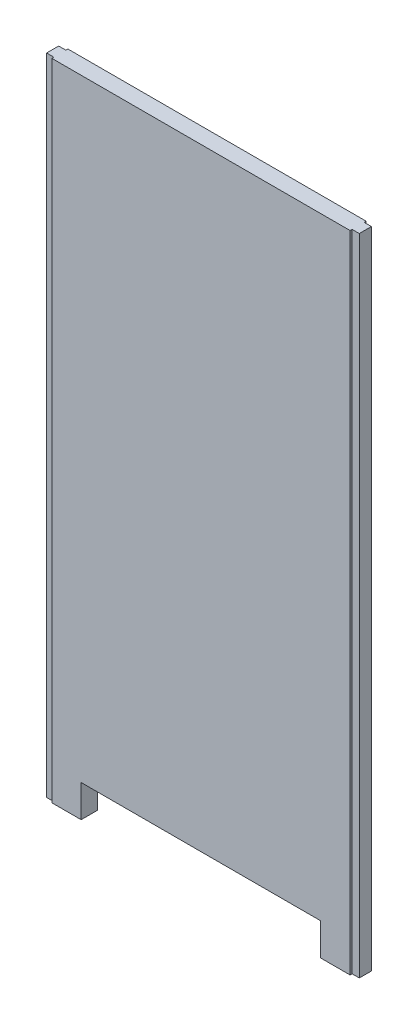
from build123d import *

# Parameters (mm, degrees)
SKETCH1_W           = 37
SKETCH1_H           = 80
BOSS_EXTRUDE1_DEPTH = 2
SKETCH2_W           = 0.9
SKETCH2_H           = 1.5
BOSS_EXTRUDE2_DEPTH = 80
SKETCH3_W           = 29.726914408
SKETCH3_H           = 4
CUT_EXTRUDE1_DEPTH  = 2


with BuildPart() as part:
    # Sketch1 → Boss-Extrude1 (new body)
    with BuildSketch(Plane.XY):
        with Locations((18.5, 40)):
            Rectangle(SKETCH1_W, SKETCH1_H)
    extrude(amount=BOSS_EXTRUDE1_DEPTH)

    # Sketch2 → Boss-Extrude2 (add)
    with BuildSketch(Plane(origin=(0, 80, 0), x_dir=(1, 0, 0), z_dir=(0, 1, 0))):
        with Locations((37.45, -1)):
            Rectangle(SKETCH2_W, SKETCH2_H)
        with Locations((-0.45, -1)):
            Rectangle(SKETCH2_W, SKETCH2_H)
    extrude(amount=-BOSS_EXTRUDE2_DEPTH)

    # Sketch3 → Cut-Extrude1 (cut)
    with BuildSketch(Plane.XY.offset(2)):
        with Locations((18.5, 2)):
            Rectangle(SKETCH3_W, SKETCH3_H)
    extrude(amount=-CUT_EXTRUDE1_DEPTH, mode=Mode.SUBTRACT)


solid = part.part
